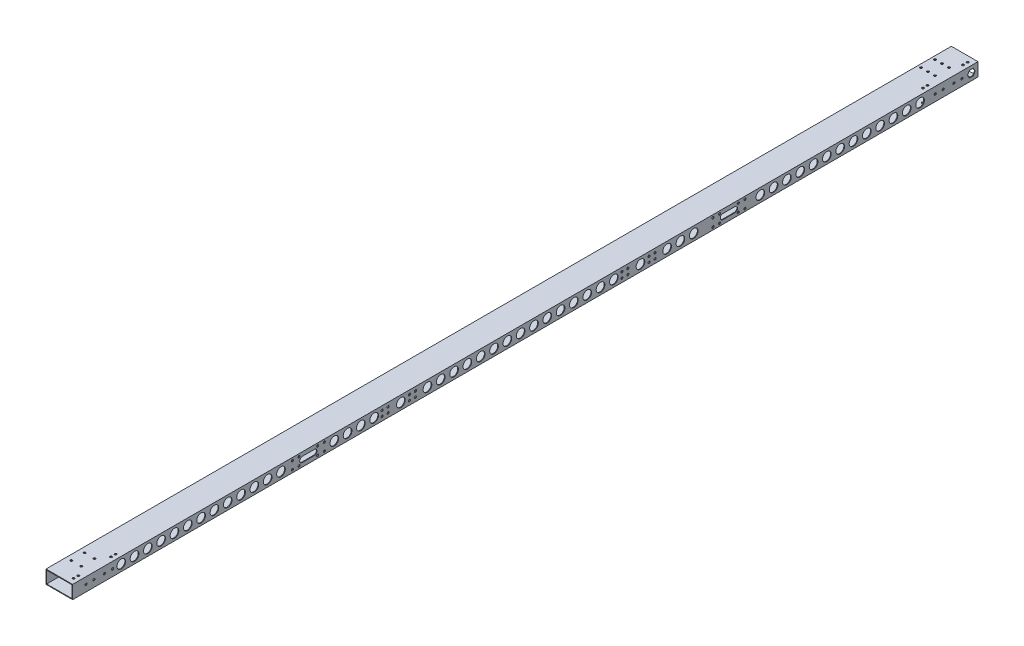
from build123d import *

# Parameters (mm, degrees)
SKETCH_1_W          = 40
SKETCH_1_H          = 20
SKETCH_1_W_2        = 38
SKETCH_1_H_2        = 18
EXTRUDE_1_DEPTH     = 1360
SKETCH_2_R          = 1.6
CUT_EXTRUDE_1_DEPTH = 1361.735095454
SKETCH_3_R          = 6.5
CUT_EXTRUDE_2_DEPTH = 1361.735095454
SKETCH_4_R          = 1.6
SKETCH_4_R_2        = 12
CUT_EXTRUDE_3_DEPTH = 1361.735095454
SKETCH_5_R          = 1.6
CUT_EXTRUDE_4_DEPTH = 1361.735095454


with BuildPart() as part:
    # 草图1 → 凸台-拉伸1 (new body)
    with BuildSketch(Plane.XY):
        with Locations((20, 10)):
            Rectangle(SKETCH_1_W, SKETCH_1_H)
        with Locations((20, 10)):
            Rectangle(SKETCH_1_W_2, SKETCH_1_H_2, mode=Mode.SUBTRACT)
    extrude(amount=EXTRUDE_1_DEPTH)

    # 草图2 → 切除-拉伸1 (cut, through all)
    with BuildSketch(Plane(origin=(40, 0, 0), x_dir=(0, 0, -1), z_dir=(1, 0, 0))):
        with Locations((-526, 14)):
            Circle(SKETCH_2_R)
        with Locations((-526, 6)):
            Circle(SKETCH_2_R)
        with Locations((-535, 14)):
            Circle(SKETCH_2_R)
        with Locations((-535, 6)):
            Circle(SKETCH_2_R)
        with Locations((-494, 14)):
            Circle(SKETCH_2_R)
        with Locations((-494, 6)):
            Circle(SKETCH_2_R)
        with Locations((-485, 14)):
            Circle(SKETCH_2_R)
        with Locations((-485, 6)):
            Circle(SKETCH_2_R)
        with Locations((-886, 14)):
            Circle(SKETCH_2_R)
        with Locations((-886, 6)):
            Circle(SKETCH_2_R)
        with Locations((-895, 14)):
            Circle(SKETCH_2_R)
        with Locations((-895, 6)):
            Circle(SKETCH_2_R)
        with Locations((-854, 14)):
            Circle(SKETCH_2_R)
        with Locations((-854, 6)):
            Circle(SKETCH_2_R)
        with Locations((-845, 14)):
            Circle(SKETCH_2_R)
        with Locations((-845, 6)):
            Circle(SKETCH_2_R)
        with Locations((-388.115427319, 16)):
            Circle(SKETCH_2_R)
        with Locations((-350.115427319, 4)):
            Circle(SKETCH_2_R)
        with Locations((-350.115427319, 16)):
            Circle(SKETCH_2_R)
        with Locations((-398.115427319, 4)):
            Circle(SKETCH_2_R)
        with Locations((-398.115427319, 16)):
            Circle(SKETCH_2_R)
        with Locations((-360.115427319, 4)):
            Circle(SKETCH_2_R)
        with Locations((-360.115427319, 16)):
            Circle(SKETCH_2_R)
        with Locations((-388.115427319, 4)):
            Circle(SKETCH_2_R)
        with Locations((-991.884572681, 16)):
            Circle(SKETCH_2_R)
        with Locations((-1029.884572681, 4)):
            Circle(SKETCH_2_R)
        with Locations((-1029.884572681, 16)):
            Circle(SKETCH_2_R)
        with Locations((-981.884572681, 4)):
            Circle(SKETCH_2_R)
        with Locations((-981.884572681, 16)):
            Circle(SKETCH_2_R)
        with Locations((-1019.884572681, 4)):
            Circle(SKETCH_2_R)
        with Locations((-1019.884572681, 16)):
            Circle(SKETCH_2_R)
        with Locations((-991.884572681, 4)):
            Circle(SKETCH_2_R)
        with BuildLine():
            Line((-365.115427319, 14), (-383.115427319, 14))
            ThreePointArc((-383.115427319, 14), (-387.115427319, 10), (-383.115427319, 6))
            Line((-383.115427319, 6), (-365.115427319, 6))
            ThreePointArc((-365.115427319, 6), (-361.115427319, 10), (-365.115427319, 14))
        make_face()
        with BuildLine():
            Line((-996.884572681, 14), (-1014.884572681, 14))
            ThreePointArc((-1014.884572681, 14), (-1018.884572681, 10), (-1014.884572681, 6))
            Line((-1014.884572681, 6), (-996.884572681, 6))
            ThreePointArc((-996.884572681, 6), (-992.884572681, 10), (-996.884572681, 14))
        make_face()
    extrude(amount=-CUT_EXTRUDE_1_DEPTH, mode=Mode.SUBTRACT)

    # 草图3 → 切除-拉伸2 (cut, through all)
    with BuildSketch(Plane(origin=(40, 0, 0), x_dir=(0, 0, -1), z_dir=(1, 0, 0))):
        with Locations((-1287, 10)):
            Circle(SKETCH_3_R)
        with Locations((-1267, 10)):
            Circle(SKETCH_3_R)
        with Locations((-1247, 10)):
            Circle(SKETCH_3_R)
        with Locations((-1227, 10)):
            Circle(SKETCH_3_R)
        with Locations((-1207, 10)):
            Circle(SKETCH_3_R)
        with Locations((-1187, 10)):
            Circle(SKETCH_3_R)
        with Locations((-1167, 10)):
            Circle(SKETCH_3_R)
        with Locations((-1147, 10)):
            Circle(SKETCH_3_R)
        with Locations((-1127, 10)):
            Circle(SKETCH_3_R)
        with Locations((-1107, 10)):
            Circle(SKETCH_3_R)
        with Locations((-1087, 10)):
            Circle(SKETCH_3_R)
        with Locations((-1067, 10)):
            Circle(SKETCH_3_R)
        with Locations((-1047, 10)):
            Circle(SKETCH_3_R)
        with Locations((-967, 10)):
            Circle(SKETCH_3_R)
        with Locations((-947, 10)):
            Circle(SKETCH_3_R)
        with Locations((-927, 10)):
            Circle(SKETCH_3_R)
        with Locations((-907, 10)):
            Circle(SKETCH_3_R)
        with Locations((-867, 10)):
            Circle(SKETCH_3_R)
        with Locations((-827, 10)):
            Circle(SKETCH_3_R)
        with Locations((-807, 10)):
            Circle(SKETCH_3_R)
        with Locations((-787, 10)):
            Circle(SKETCH_3_R)
        with Locations((-767, 10)):
            Circle(SKETCH_3_R)
        with Locations((-747, 10)):
            Circle(SKETCH_3_R)
        with Locations((-727, 10)):
            Circle(SKETCH_3_R)
        with Locations((-707, 10)):
            Circle(SKETCH_3_R)
        with Locations((-687, 10)):
            Circle(SKETCH_3_R)
        with Locations((-667, 10)):
            Circle(SKETCH_3_R)
        with Locations((-647, 10)):
            Circle(SKETCH_3_R)
        with Locations((-627, 10)):
            Circle(SKETCH_3_R)
        with Locations((-607, 10)):
            Circle(SKETCH_3_R)
        with Locations((-587, 10)):
            Circle(SKETCH_3_R)
        with Locations((-567, 10)):
            Circle(SKETCH_3_R)
        with Locations((-547, 10)):
            Circle(SKETCH_3_R)
        with Locations((-507, 10)):
            Circle(SKETCH_3_R)
        with Locations((-467, 10)):
            Circle(SKETCH_3_R)
        with Locations((-447, 10)):
            Circle(SKETCH_3_R)
        with Locations((-427, 10)):
            Circle(SKETCH_3_R)
        with Locations((-327, 10)):
            Circle(SKETCH_3_R)
        with Locations((-307, 10)):
            Circle(SKETCH_3_R)
        with Locations((-287, 10)):
            Circle(SKETCH_3_R)
        with Locations((-267, 10)):
            Circle(SKETCH_3_R)
        with Locations((-247, 10)):
            Circle(SKETCH_3_R)
        with Locations((-227, 10)):
            Circle(SKETCH_3_R)
        with Locations((-207, 10)):
            Circle(SKETCH_3_R)
        with Locations((-187, 10)):
            Circle(SKETCH_3_R)
        with Locations((-167, 10)):
            Circle(SKETCH_3_R)
        with Locations((-147, 10)):
            Circle(SKETCH_3_R)
        with Locations((-127, 10)):
            Circle(SKETCH_3_R)
        with Locations((-107, 10)):
            Circle(SKETCH_3_R)
        with Locations((-87, 10)):
            Circle(SKETCH_3_R)
        Polygon((-7.113248654, 15), (-12.886751346, 15), (-15.773502692, 10), (-12.886751346, 5), (-7.113248654, 5), (-4.226497308, 10), align=None)
    extrude(amount=-CUT_EXTRUDE_2_DEPTH, mode=Mode.SUBTRACT)

    # 草图4 → 切除-拉伸3 (cut, through all)
    with BuildSketch(Plane.XZ):
        with Locations((8, 1310)):
            Circle(SKETCH_4_R)
        with Locations((23, 1310)):
            Circle(SKETCH_4_R)
        with Locations((8, 1330)):
            Circle(SKETCH_4_R)
        with Locations((23, 1330)):
            Circle(SKETCH_4_R)
        with Locations((-30, 1320)):
            Circle(SKETCH_4_R_2)
        with Locations((26, 50.5)):
            Circle(SKETCH_4_R)
        with Locations((26, 29.5)):
            Circle(SKETCH_4_R)
        with Locations((5, 50.5)):
            Circle(SKETCH_4_R)
        with Locations((5, 29.5)):
            Circle(SKETCH_4_R)
        with Locations((15.5, 29.5)):
            Circle(SKETCH_4_R)
        with Locations((15.5, 50.5)):
            Circle(SKETCH_4_R)
        with Locations((33, 8.5)):
            Circle(SKETCH_4_R)
        with Locations((33, 15.5)):
            Circle(SKETCH_4_R)
        with Locations((33, 68.789300741)):
            Circle(SKETCH_4_R)
        with Locations((33, 75.789300741)):
            Circle(SKETCH_4_R)
        with Locations((33, 1288.5)):
            Circle(SKETCH_4_R)
        with Locations((33, 1295.5)):
            Circle(SKETCH_4_R)
        with Locations((33, 1344.5)):
            Circle(SKETCH_4_R)
        with Locations((33, 1351.5)):
            Circle(SKETCH_4_R)
    extrude(amount=-CUT_EXTRUDE_3_DEPTH, mode=Mode.SUBTRACT)

    # 草图5 → 切除-拉伸4 (cut, through all)
    with BuildSketch(Plane(origin=(40, 0, 0), x_dir=(0, 0, -1), z_dir=(1, 0, 0))):
        with Locations((-1300, 10)):
            Circle(SKETCH_5_R)
        with Locations((-1340, 10)):
            Circle(SKETCH_5_R)
        with Locations((-1312, 10)):
            Circle(SKETCH_5_R)
        with Locations((-1328, 10)):
            Circle(SKETCH_5_R)
        with Locations((-64.289300741, 10)):
            Circle(SKETCH_5_R)
        with Locations((-24.289300741, 10)):
            Circle(SKETCH_5_R)
        with Locations((-52.289300741, 10)):
            Circle(SKETCH_5_R)
        with Locations((-36.289300741, 10)):
            Circle(SKETCH_5_R)
    extrude(amount=-CUT_EXTRUDE_4_DEPTH, mode=Mode.SUBTRACT)


solid = part.part
